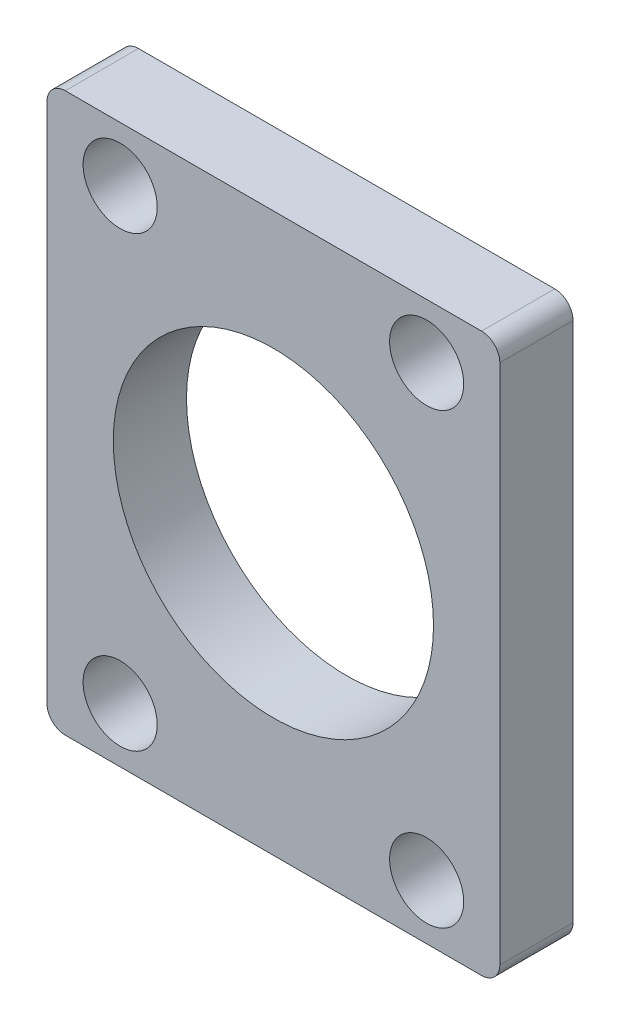
from build123d import *

# Parameters (mm, degrees)
SKETCH1_W           = 49.5
SKETCH1_H           = 61
SKETCH1_R           = 17.5
BOSS_EXTRUDE1_DEPTH = 8
FILLET1_R           = 2
SKETCH25_R          = 4.05
CUT_EXTRUDE24_DEPTH = 20


with BuildPart() as part:
    # Sketch1 → Boss-Extrude1 (new body)
    with BuildSketch(Plane.XY):
        with Locations((-375.83204095, -9.5)):
            Rectangle(SKETCH1_W, SKETCH1_H)
        with Locations((-375.83204095, -9.5)):
            Circle(SKETCH1_R, mode=Mode.SUBTRACT)
    extrude(amount=BOSS_EXTRUDE1_DEPTH)

    # Fillet1
    fillet1_edges = [part.edges().sort_by_distance(p)[0] for p in [
        (-400.58204095, -40, 4),
        (-400.58204095, 21, 4),
        (-351.08204095, 21, 4),
        (-351.08204095, -40, 4),
    ]]
    fillet(fillet1_edges, radius=FILLET1_R)

    # Sketch25 → Cut-Extrude24 (cut)
    with BuildSketch(Plane(origin=(-362.113949842, -45.191927803, 10), x_dir=(1, 0, 0), z_dir=(0, 0, 1))):
        with Locations((-30.468091108, 11.191927803)):
            Circle(SKETCH25_R)
        with Locations((-30.468091108, 60.191927803)):
            Circle(SKETCH25_R)
        with Locations((3.031908892, 11.191927803)):
            Circle(SKETCH25_R)
        with Locations((3.031908892, 60.191927803)):
            Circle(SKETCH25_R)
    extrude(amount=-CUT_EXTRUDE24_DEPTH, mode=Mode.SUBTRACT)


solid = part.part
